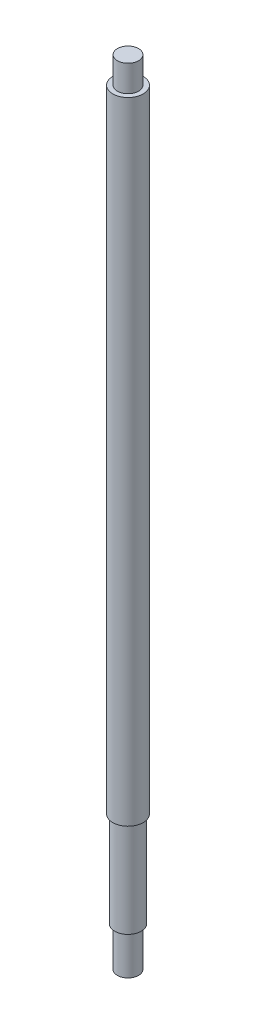
from build123d import *


with BuildPart() as part:
    # Sketch1 → Revolve1 (revolve)
    with BuildSketch(Plane.XY, mode=Mode.PRIVATE) as revolve1_sk:
        Polygon((0, 0), (4, 0), (4, -10), (5.75, -10), (5.75, -249), (5, -249), (5, -285), (4, -285), (4, -300), (0, -300), align=None)
    revolve(revolve1_sk.sketch.rotate(Axis((0, 24.014554369, 0), (0, -1, 0)), 90), axis=Axis((0, 24.014554369, 0), (0, -1, 0)))


solid = part.part
